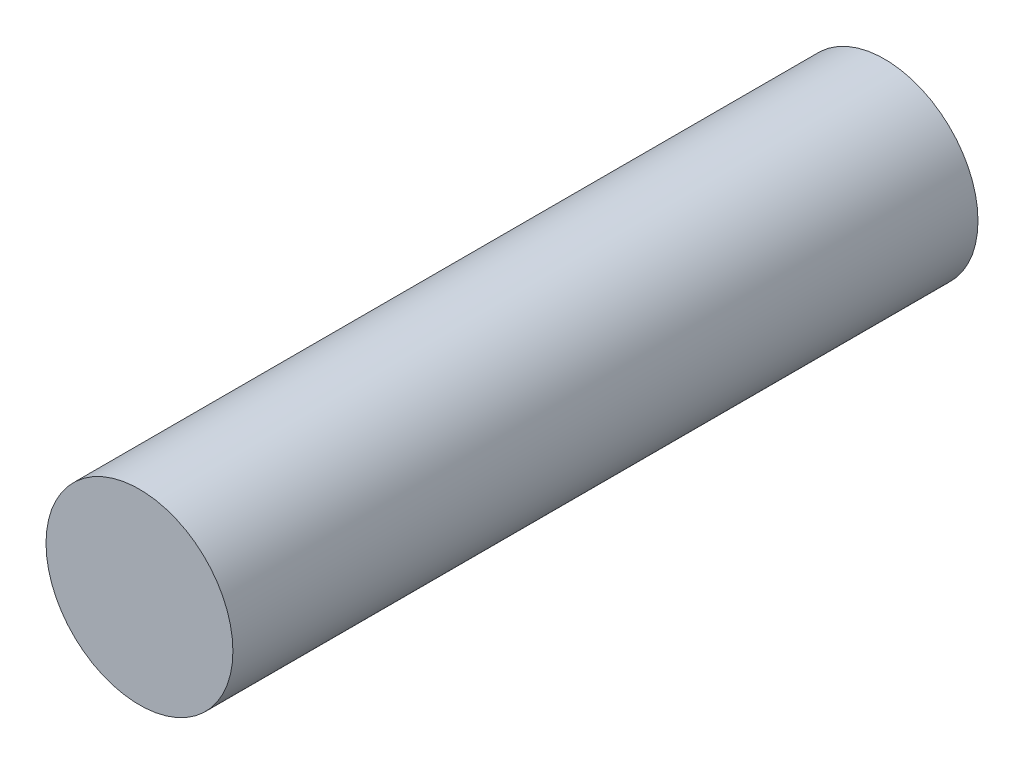
from build123d import *

# Parameters (mm, degrees)
SKETCH1_R           = 4.778643246
BOSS_EXTRUDE1_DEPTH = 38.1


with BuildPart() as part:
    # Sketch1 → Boss-Extrude1 (new body)
    with BuildSketch(Plane.XY):
        with Locations((0, 52.281625638)):
            Circle(SKETCH1_R)
    extrude(amount=-BOSS_EXTRUDE1_DEPTH)


solid = part.part
